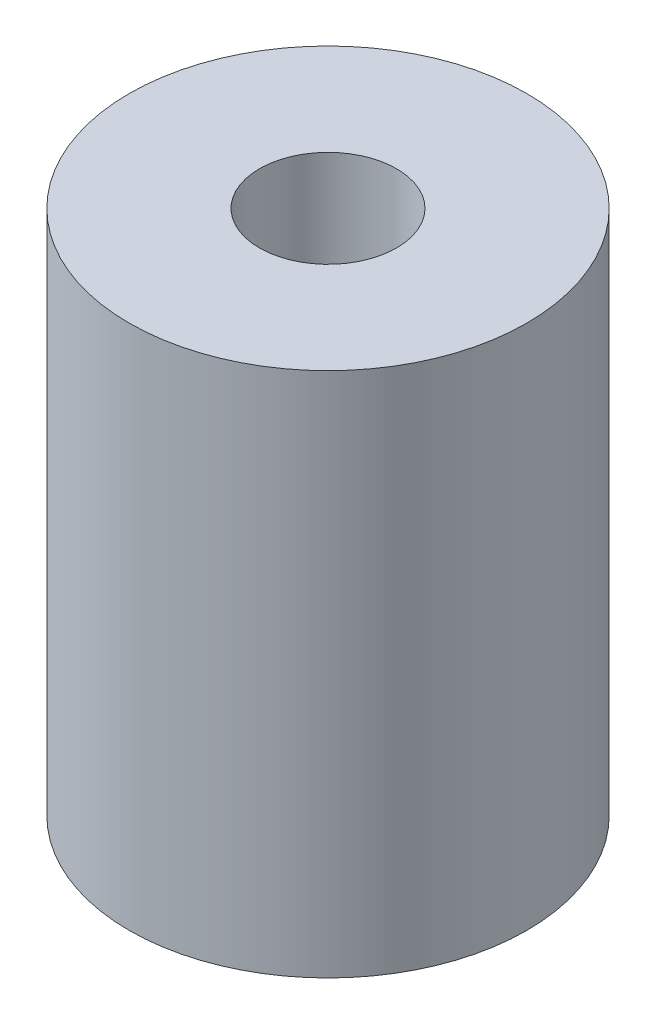
from build123d import *

# Parameters (mm, degrees)
SKETCH1_R           = 3.9751
BOSS_EXTRUDE1_DEPTH = 10.5156
SKETCH2_R           = 1.3716
CUT_EXTRUDE1_DEPTH  = 12.923954184


with BuildPart() as part:
    # Sketch1 → Boss-Extrude1 (new body)
    with BuildSketch(Plane(origin=(0, 0, 0), x_dir=(1, 0, 0), z_dir=(0, 1, 0))):
        with Locations(Location((0, 0, 0), (0, 0, 270))):
            Circle(SKETCH1_R)
    extrude(amount=BOSS_EXTRUDE1_DEPTH)

    # Sketch2 → Cut-Extrude1 (cut, through all)
    with BuildSketch(Plane(origin=(0, 10.5156, 0), x_dir=(1, 0, 0), z_dir=(0, 1, 0))):
        with Locations(Location((0, 0, 0), (0, 0, 270))):
            Circle(SKETCH2_R)
    extrude(amount=-CUT_EXTRUDE1_DEPTH, mode=Mode.SUBTRACT)


solid = part.part
